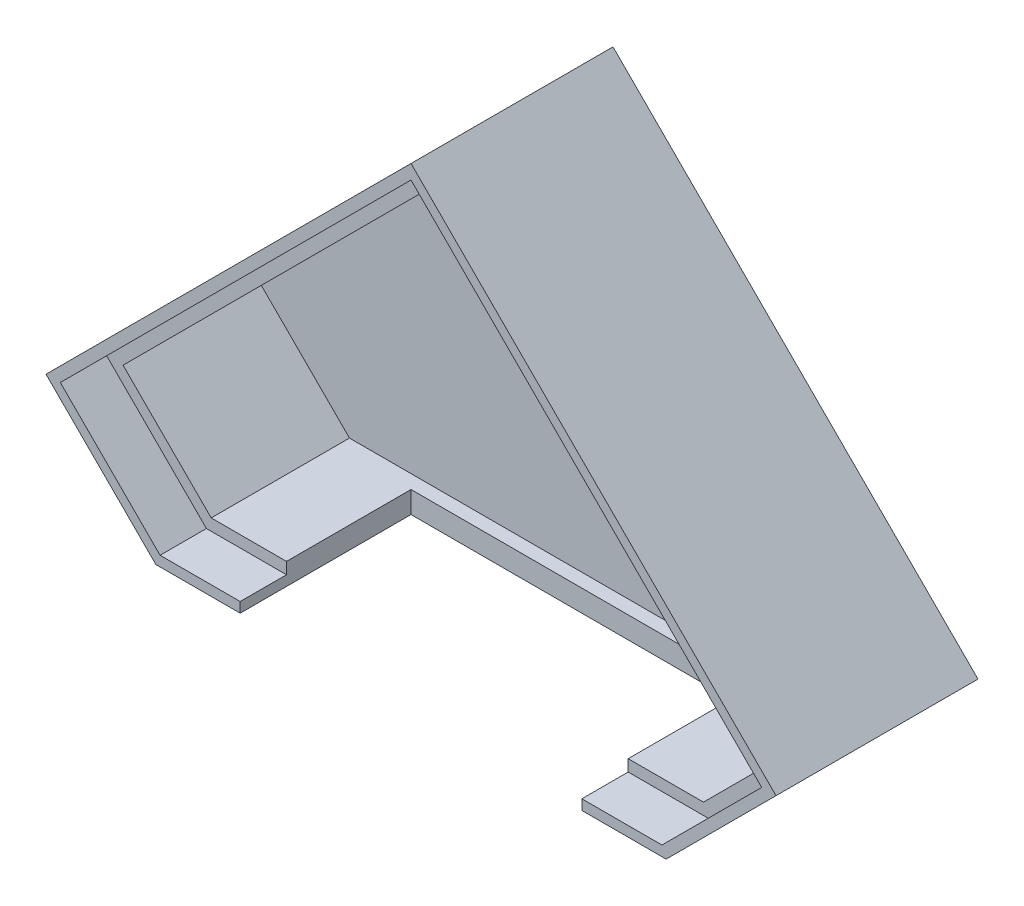
from build123d import *

# Parameters (mm, degrees)
EXTRUDE_1_DEPTH          = 12.75
EXTRUDE_1_DEPTH_BACK     = 12.75
EXTRUDE_1_2_DEPTH        = 1.2
EXTRUDE_2_DEPTH          = 1.2
SKETCH_4_W               = 23.6
SKETCH_4_H               = 23.6
CUT_EXTRUDE_1_DEPTH      = 1.5
CUT_EXTRUDE_2_DEPTH      = 35.680906203
CUT_EXTRUDE_2_DEPTH_BACK = 35.680906203
SKETCH_5_W               = 13.95
SKETCH_5_H               = 32.801494515
CUT_EXTRUDE_3_DEPTH      = 3.2


with BuildPart() as part:
    # Эскиз1 → Extrude 1 (new, two sides: drawn at the far end of the back side and taken through both)
    with BuildSketch(Plane.XY.offset(-EXTRUDE_1_DEPTH_BACK)):
        Polygon((-17.621320344, -13.5), (17.621320344, -13.5), (25.211407429, -5.909912914), (0, 19.301494515), (-25.211407429, -5.909912914), align=None)
        Polygon((-17, -12), (17, -12), (23.090087086, -5.909912914), (0, 17.180174171), (-23.090087086, -5.909912914), align=None, mode=Mode.SUBTRACT)
    extrude(amount=EXTRUDE_1_DEPTH + EXTRUDE_1_DEPTH_BACK)

    # Эскиз2 → Extrude 1 2 (add)
    with BuildSketch(Plane.XY.offset(12.75)):
        Polygon((25.211407429, -5.909912914), (0, 19.301494515), (-25.211407429, -5.909912914), (-17.621320344, -13.5), (17.621320344, -13.5), align=None)
    extrude(amount=EXTRUDE_1_2_DEPTH)

    # Эскиз3 → Бобышка-Вытянуть2 (add)
    with BuildSketch(Plane(origin=(0, 0, -12.75), x_dir=(-1, 0, 0), z_dir=(0, 0, -1))):
        Polygon((0, 19.301494515), (25.211407429, -5.909912914), (17.621320344, -13.5), (-17.621320344, -13.5), (-25.211407429, -5.909912914), align=None)
    extrude(amount=EXTRUDE_2_DEPTH)

    # Эскиз4 → Вырез-Вытянуть1 (cut)
    with BuildSketch(Plane.XZ.offset(13.5)):
        Rectangle(SKETCH_4_W, SKETCH_4_H)
    extrude(amount=-CUT_EXTRUDE_1_DEPTH, mode=Mode.SUBTRACT)

    # Эскиз5 → Вырез-Вытянуть2 (cut, two sides: drawn at the far end of the back side and taken through both)
    with BuildSketch(Plane(origin=(0, 0, 0), x_dir=(0, 0, -1), z_dir=(1, 0, 0)).offset(-CUT_EXTRUDE_2_DEPTH_BACK)):
        with Locations((-6.975, 2.900747258)):
            Rectangle(SKETCH_5_W, SKETCH_5_H)
    extrude(amount=CUT_EXTRUDE_2_DEPTH + CUT_EXTRUDE_2_DEPTH_BACK, mode=Mode.SUBTRACT)

    # Эскиз6 → Вырез-Вытянуть3 (cut)
    with BuildSketch(Plane.XY):
        Polygon((-17.33137085, -12.8), (17.33137085, -12.8), (24.221457935, -5.909912914), (0, 18.311545021), (-24.221457935, -5.909912914), align=None)
    extrude(amount=-CUT_EXTRUDE_3_DEPTH, mode=Mode.SUBTRACT)


solid = part.part
